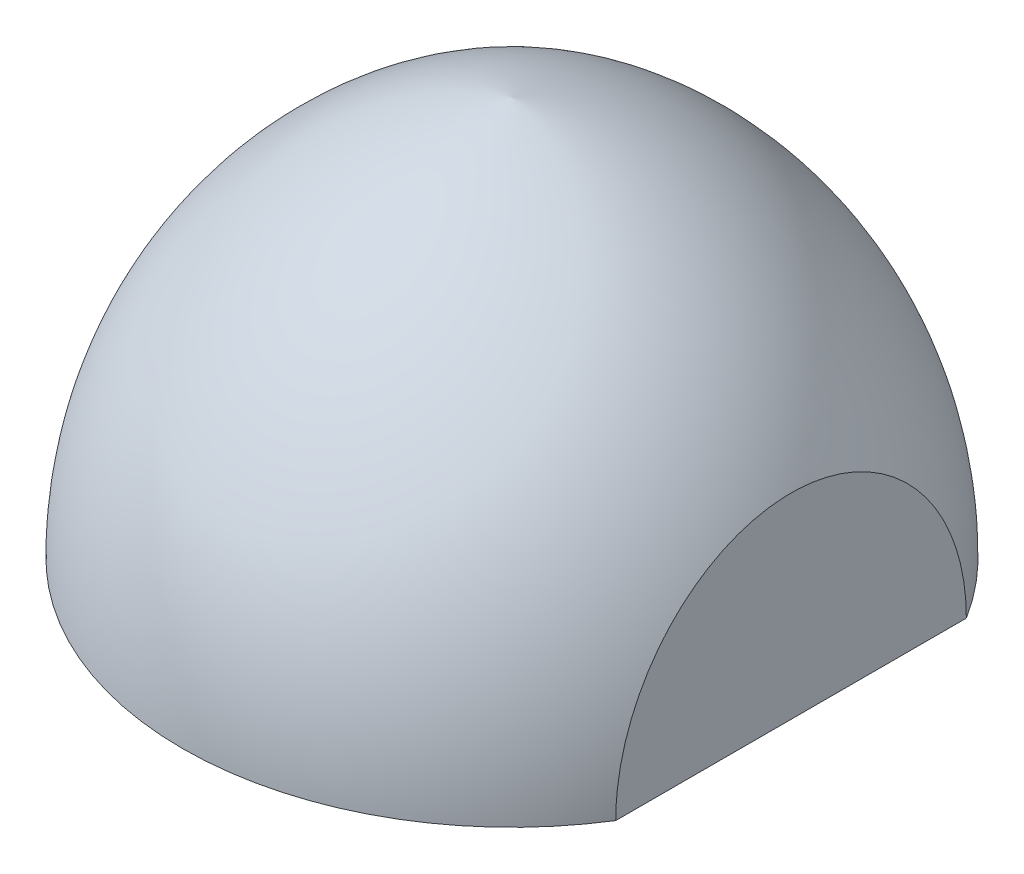
from build123d import *

# Parameters (mm, degrees)
SKETCH2_OUTSIDE_W   = 164.146
SKETCH2_OUTSIDE_H   = 164.146
SKETCH2_OUTSIDE_W_2 = 105
SKETCH2_OUTSIDE_H_2 = 145.767420334
CUT_EXTRUDE2_DEPTH  = 116.381974501
BOSS_EXTRUDE2_REACH = 112.568
SKETCH3_W           = 3.579145551
SKETCH3_H           = 65.962110336


with BuildPart() as part:
    # Sketch1 → Revolve1 (revolve)
    with BuildSketch(Plane.XY):
        with BuildLine():
            Line((62, 0), (59, 0))
            ThreePointArc((59, 0), (42.363721251, 46.52102369), (0, 71.943189953))
            Line((0, 71.943189953), (0, 75))
            ThreePointArc((0, 75), (44.493217858, 48.65439343), (62, 0))
        make_face()
    revolve(axis=Axis((0, 75, 0), (0, -1, 0)))

    # Sketch2 outside → Cut-Extrude2 (cut, through all)
    with BuildSketch(Plane(origin=(0, 0, 0), x_dir=(-1, 0, 0), z_dir=(0, -1, 0))):
        Rectangle(SKETCH2_OUTSIDE_W, SKETCH2_OUTSIDE_H)
        Rectangle(SKETCH2_OUTSIDE_W_2, SKETCH2_OUTSIDE_H_2, mode=Mode.SUBTRACT)
    extrude(amount=-CUT_EXTRUDE2_DEPTH, mode=Mode.SUBTRACT)

    # Sketch3 → Boss-Extrude2 (add, up to next)
    with BuildSketch(Plane.XZ, mode=Mode.PRIVATE) as boss_extrude2_sk1:
        with Locations((-50.710427225, 0)):
            Rectangle(SKETCH3_W, SKETCH3_H)
    boss_extrude2_tool1 = extrude(boss_extrude2_sk1.sketch, amount=-BOSS_EXTRUDE2_REACH, mode=Mode.PRIVATE) - part.part
    # Sketch3 → Boss-Extrude2 (add, up to next)
    with BuildSketch(Plane.XZ, mode=Mode.PRIVATE) as boss_extrude2_sk2:
        with Locations((50.710427225, 0)):
            Rectangle(SKETCH3_W, SKETCH3_H)
    boss_extrude2_tool2 = extrude(boss_extrude2_sk2.sketch, amount=-BOSS_EXTRUDE2_REACH, mode=Mode.PRIVATE) - part.part
    add(boss_extrude2_tool1.solids().sort_by_distance((-50.710427, 0, 0))[0])
    add(boss_extrude2_tool2.solids().sort_by_distance((50.710427, 0, 0))[0])


solid = part.part
